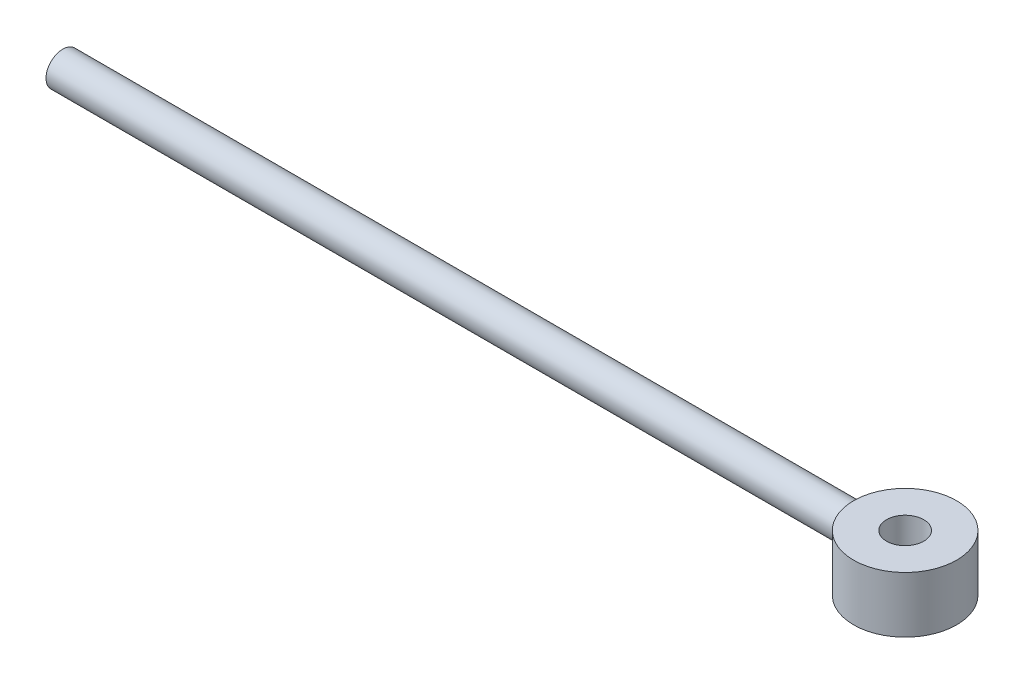
from build123d import *

# Parameters (mm, degrees)
SKETCH_1_R          = 0.6
EXTRUDE_1_DEPTH     = 30
SKETCH_2_R          = 1.837847415
EXTRUDE_2_DEPTH     = 1
SKETCH_3_R          = 0.665703361
CUT_EXTRUDE_1_DEPTH = 32.999712653


with BuildPart() as part:
    # 草图1 → 凸台-拉伸1 (new body)
    with BuildSketch(Plane(origin=(0, 0, 0), x_dir=(0, 0, -1), z_dir=(1, 0, 0))):
        Circle(SKETCH_1_R)
    extrude(amount=EXTRUDE_1_DEPTH)

    # 草图2 → 凸台-拉伸2 (add, symmetric)
    with BuildSketch(Plane(origin=(8.379426917, -0.245734266, -12), x_dir=(1, 0, 0), z_dir=(0, 1, 0))):
        with Locations(Location((21.666952485, -12, 0), (0, 0, 270))):
            Circle(SKETCH_2_R)
    extrude(amount=EXTRUDE_2_DEPTH, both=True)

    # 草图3 → 切除-拉伸1 (cut, through all)
    with BuildSketch(Plane(origin=(0, -1.245734266, 0), x_dir=(-1, 0, 0), z_dir=(0, -1, 0))):
        with Locations(Location((-30.046379401, 0, 0), (0, 0, 90))):
            Circle(SKETCH_3_R)
    extrude(amount=-CUT_EXTRUDE_1_DEPTH, mode=Mode.SUBTRACT)


solid = part.part
